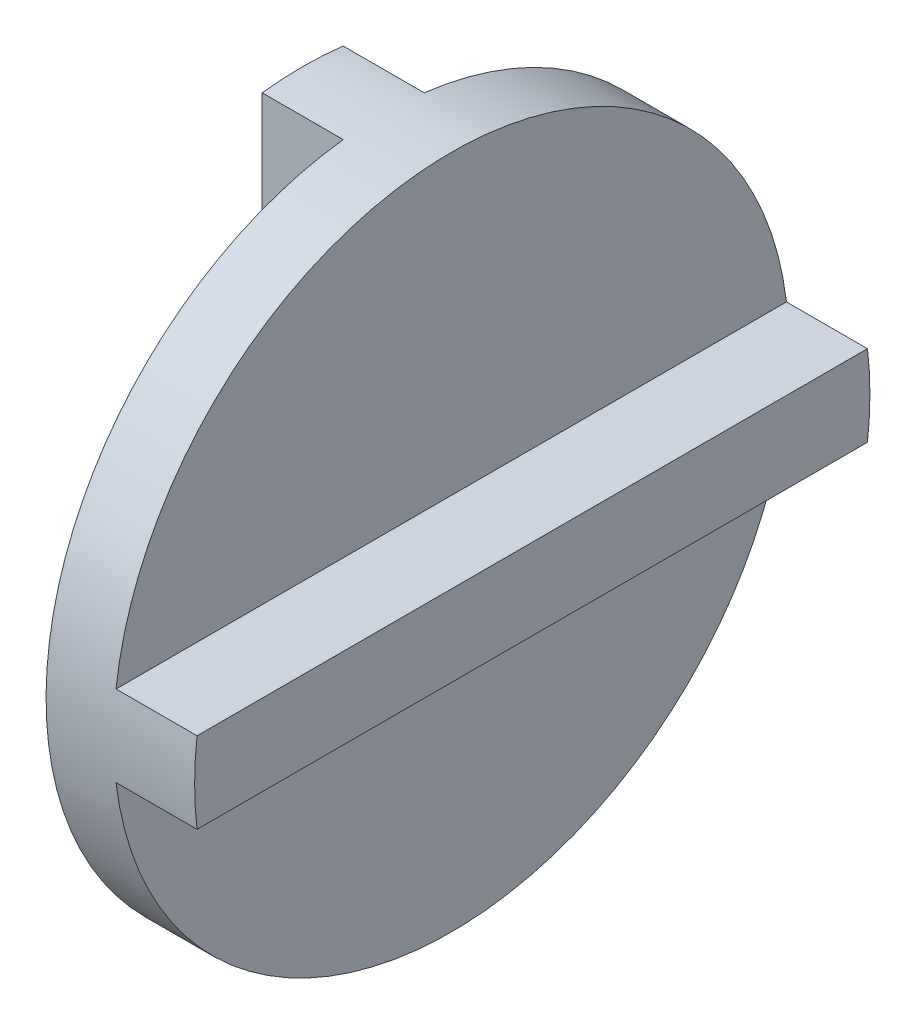
from build123d import *
from build123d.topology import SkipClean

# Parameters (mm, degrees)
SKETCH1_R           = 50
BOSS_EXTRUDE1_DEPTH = 10
BOSS_EXTRUDE2_DEPTH = 12
BOSS_EXTRUDE3_START = 12
BOSS_EXTRUDE3_DEPTH = 12


with BuildPart() as part:
    # Sketch1 → Boss-Extrude1 (new body)
    with BuildSketch(Plane(origin=(0, 0, 0), x_dir=(0, 0, -1), z_dir=(1, 0, 0))):
        Circle(SKETCH1_R)
    extrude(amount=BOSS_EXTRUDE1_DEPTH)

    # Sketch2 → Boss-Extrude2 (add)
    with SkipClean():  # the faces are left unmerged after this step: merging them gives an invalid solid
        with BuildSketch(Plane(origin=(10, 0, 0), x_dir=(0, 0, -1), z_dir=(1, 0, 0))):
            with BuildLine():
                Line((-49.638694584, 6), (49.638694584, 6))
                ThreePointArc((49.638694584, 6), (50, 0), (49.638694584, -6))
                Line((49.638694584, -6), (-49.638694584, -6))
                ThreePointArc((-49.638694584, -6), (-50, 0), (-49.638694584, 6))
            make_face()
        extrude(amount=BOSS_EXTRUDE2_DEPTH)

    # Sketch3 → Boss-Extrude3 (add)
    with SkipClean():  # the faces are left unmerged after this step: merging them gives an invalid solid
        with BuildSketch(Plane.ZY.offset(BOSS_EXTRUDE3_START)):
            with BuildLine():
                ThreePointArc((6, 49.638694584), (0, 50), (-6, 49.638694584))
                Line((-6, 49.638694584), (-6, -49.638694584))
                ThreePointArc((-6, -49.638694584), (0, -50), (6, -49.638694584))
                Line((6, -49.638694584), (6, 49.638694584))
            make_face()
        extrude(amount=-BOSS_EXTRUDE3_DEPTH)


solid = part.part
